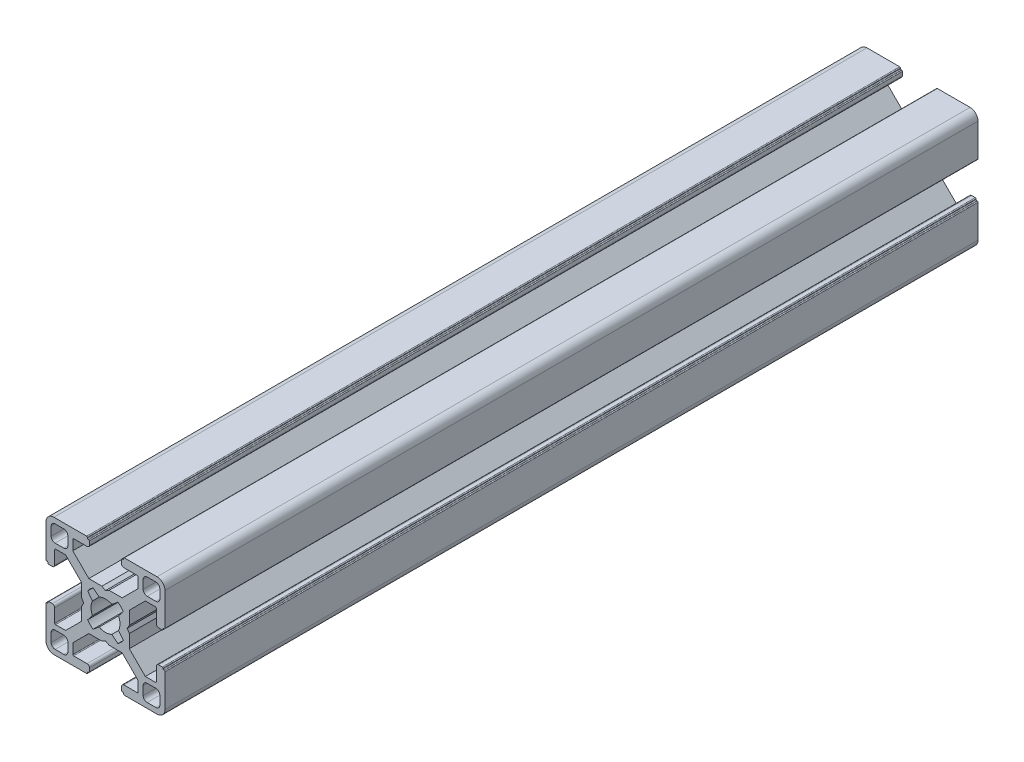
from build123d import *

# Parameters (mm, degrees)
BASE_EXTRUDE_DEPTH = 205


with BuildPart() as part:
    # Sketch1 → Base-Extrude (new body)
    with BuildSketch(Plane.XY):
        with BuildLine():
            Line((6.00446543, 0.899999619), (5.484852164, 0))
            Line((5.484852164, 0), (6.00446543, -0.899999619))
            Line((6.00446543, -0.899999619), (6.00446543, -4.204465866))
            Line((6.00446543, -4.204465866), (10.049999564, -8.25))
            Line((10.049999564, -8.25), (12.59999928, -8.25))
            ThreePointArc((12.59999928, -8.25), (12.741420837, -8.191421273), (12.799999564, -8.049999716))
            Line((12.799999564, -8.049999716), (12.799999564, -4.649999613))
            ThreePointArc((12.799999564, -4.649999613), (12.975735606, -4.225735278), (13.39999994, -4.049999237))
            Line((13.39999994, -4.049999237), (14.300000043, -4.049999237))
            ThreePointArc((14.300000043, -4.049999237), (14.4414216, -4.108577964), (14.500000327, -4.249999521))
            Line((14.500000327, -4.249999521), (14.500000327, -4.349998953))
            ThreePointArc((14.500000327, -4.349998953), (14.558579054, -4.49142051), (14.700000611, -4.549999237))
            Line((14.700000611, -4.549999237), (14.799999716, -4.549999237))
            ThreePointArc((14.799999716, -4.549999237), (14.941421273, -4.608577964), (15, -4.749999521))
            Line((15, -4.749999521), (15, -13.000000346))
            ThreePointArc((15, -13.000000346), (14.414213664, -14.414213664), (13.000000346, -15))
            Line((13.000000346, -15), (4.749999945, -15))
            ThreePointArc((4.749999945, -15), (4.60857832, -14.941421245), (4.549999564, -14.799999619))
            Line((4.549999564, -14.799999619), (4.549999564, -14.69999942))
            ThreePointArc((4.549999564, -14.69999942), (4.49142109, -14.558578474), (4.350000144, -14.5))
            Line((4.350000144, -14.5), (4.250000374, -14.5))
            ThreePointArc((4.250000374, -14.5), (4.108578753, -14.441421247), (4.05, -14.299999626))
            Line((4.05, -14.299999626), (4.05, -13.399999434))
            ThreePointArc((4.05, -13.399999434), (4.225735989, -12.975735226), (4.650000197, -12.799999237))
            Line((4.650000197, -12.799999237), (8.049999924, -12.799999237))
            ThreePointArc((8.049999924, -12.799999237), (8.191421565, -12.741420475), (8.250000327, -12.599998834))
            Line((8.250000327, -12.599998834), (8.250000327, -10.049999237))
            Line((8.250000327, -10.049999237), (4.204466193, -6))
            Line((4.204466193, -6), (0.899999946, -6))
            Line((0.899999946, -6), (0, -5.484851837))
            Line((0, -5.484851837), (-0.899999946, -6))
            Line((-0.899999946, -6), (-4.204466193, -6))
            Line((-4.204466193, -6), (-8.250000327, -10.049999237))
            Line((-8.250000327, -10.049999237), (-8.250000327, -12.599998834))
            ThreePointArc((-8.250000327, -12.599998834), (-8.191421565, -12.741420475), (-8.049999924, -12.799999237))
            Line((-8.049999924, -12.799999237), (-4.650000197, -12.799999237))
            ThreePointArc((-4.650000197, -12.799999237), (-4.225735989, -12.975735226), (-4.05, -13.399999434))
            Line((-4.05, -13.399999434), (-4.05, -14.299999626))
            ThreePointArc((-4.05, -14.299999626), (-4.108578753, -14.441421247), (-4.250000374, -14.5))
            Line((-4.250000374, -14.5), (-4.350000144, -14.5))
            ThreePointArc((-4.350000144, -14.5), (-4.49142109, -14.558578474), (-4.549999564, -14.69999942))
            Line((-4.549999564, -14.69999942), (-4.549999564, -14.799999619))
            ThreePointArc((-4.549999564, -14.799999619), (-4.60857832, -14.941421245), (-4.749999945, -15))
            Line((-4.749999945, -15), (-13.000000346, -15))
            ThreePointArc((-13.000000346, -15), (-14.414213664, -14.414213664), (-15, -13.000000346))
            Line((-15, -13.000000346), (-15, -4.749999521))
            ThreePointArc((-15, -4.749999521), (-14.941421273, -4.608577964), (-14.799999716, -4.549999237))
            Line((-14.799999716, -4.549999237), (-14.700000611, -4.549999237))
            ThreePointArc((-14.700000611, -4.549999237), (-14.558579054, -4.49142051), (-14.500000327, -4.349998953))
            Line((-14.500000327, -4.349998953), (-14.500000327, -4.249999521))
            ThreePointArc((-14.500000327, -4.249999521), (-14.4414216, -4.108577964), (-14.300000043, -4.049999237))
            Line((-14.300000043, -4.049999237), (-13.39999994, -4.049999237))
            ThreePointArc((-13.39999994, -4.049999237), (-12.975735606, -4.225735278), (-12.799999564, -4.649999613))
            Line((-12.799999564, -4.649999613), (-12.799999564, -8.049999716))
            ThreePointArc((-12.799999564, -8.049999716), (-12.741420837, -8.191421273), (-12.59999928, -8.25))
            Line((-12.59999928, -8.25), (-10.049999564, -8.25))
            Line((-10.049999564, -8.25), (-6.00446543, -4.204465866))
            Line((-6.00446543, -4.204465866), (-6.00446543, -0.899999619))
            Line((-6.00446543, -0.899999619), (-5.484852164, 0))
            Line((-5.484852164, 0), (-6.00446543, 0.899999619))
            Line((-6.00446543, 0.899999619), (-6.00446543, 4.204465866))
            Line((-6.00446543, 4.204465866), (-10.049999564, 8.25))
            Line((-10.049999564, 8.25), (-12.59999928, 8.25))
            ThreePointArc((-12.59999928, 8.25), (-12.741420837, 8.191421273), (-12.799999564, 8.049999716))
            Line((-12.799999564, 8.049999716), (-12.799999564, 4.649999613))
            ThreePointArc((-12.799999564, 4.649999613), (-12.975735606, 4.225735278), (-13.39999994, 4.049999237))
            Line((-13.39999994, 4.049999237), (-14.300000043, 4.049999237))
            ThreePointArc((-14.300000043, 4.049999237), (-14.4414216, 4.108577964), (-14.500000327, 4.249999521))
            Line((-14.500000327, 4.249999521), (-14.500000327, 4.349998953))
            ThreePointArc((-14.500000327, 4.349998953), (-14.558579054, 4.49142051), (-14.700000611, 4.549999237))
            Line((-14.700000611, 4.549999237), (-14.799999716, 4.549999237))
            ThreePointArc((-14.799999716, 4.549999237), (-14.941421273, 4.608577964), (-15, 4.749999521))
            Line((-15, 4.749999521), (-15, 13.000000346))
            ThreePointArc((-15, 13.000000346), (-14.414213664, 14.414213664), (-13.000000346, 15))
            Line((-13.000000346, 15), (-4.749999945, 15))
            ThreePointArc((-4.749999945, 15), (-4.60857832, 14.941421245), (-4.549999564, 14.799999619))
            Line((-4.549999564, 14.799999619), (-4.549999564, 14.69999942))
            ThreePointArc((-4.549999564, 14.69999942), (-4.49142109, 14.558578474), (-4.350000144, 14.5))
            Line((-4.350000144, 14.5), (-4.250000374, 14.5))
            ThreePointArc((-4.250000374, 14.5), (-4.108578753, 14.441421247), (-4.05, 14.299999626))
            Line((-4.05, 14.299999626), (-4.05, 13.399999434))
            ThreePointArc((-4.05, 13.399999434), (-4.225735989, 12.975735226), (-4.650000197, 12.799999237))
            Line((-4.650000197, 12.799999237), (-8.049999924, 12.799999237))
            ThreePointArc((-8.049999924, 12.799999237), (-8.191421565, 12.741420475), (-8.250000327, 12.599998834))
            Line((-8.250000327, 12.599998834), (-8.250000327, 10.049999237))
            Line((-8.250000327, 10.049999237), (-4.204466193, 6))
            Line((-4.204466193, 6), (-0.899999946, 6))
            Line((-0.899999946, 6), (0, 5.484851837))
            Line((0, 5.484851837), (0.899999946, 6))
            Line((0.899999946, 6), (4.204466193, 6))
            Line((4.204466193, 6), (8.250000327, 10.049999237))
            Line((8.250000327, 10.049999237), (8.250000327, 12.599998834))
            ThreePointArc((8.250000327, 12.599998834), (8.191421565, 12.741420475), (8.049999924, 12.799999237))
            Line((8.049999924, 12.799999237), (4.650000197, 12.799999237))
            ThreePointArc((4.650000197, 12.799999237), (4.225735989, 12.975735226), (4.05, 13.399999434))
            Line((4.05, 13.399999434), (4.05, 14.299999626))
            ThreePointArc((4.05, 14.299999626), (4.108578753, 14.441421247), (4.250000374, 14.5))
            Line((4.250000374, 14.5), (4.350000144, 14.5))
            ThreePointArc((4.350000144, 14.5), (4.49142109, 14.558578474), (4.549999564, 14.69999942))
            Line((4.549999564, 14.69999942), (4.549999564, 14.799999619))
            ThreePointArc((4.549999564, 14.799999619), (4.60857832, 14.941421245), (4.749999945, 15))
            Line((4.749999945, 15), (13.000000346, 15))
            ThreePointArc((13.000000346, 15), (14.414213664, 14.414213664), (15, 13.000000346))
            Line((15, 13.000000346), (15, 4.749999521))
            ThreePointArc((15, 4.749999521), (14.941421273, 4.608577964), (14.799999716, 4.549999237))
            Line((14.799999716, 4.549999237), (14.700000611, 4.549999237))
            ThreePointArc((14.700000611, 4.549999237), (14.558579054, 4.49142051), (14.500000327, 4.349998953))
            Line((14.500000327, 4.349998953), (14.500000327, 4.249999521))
            ThreePointArc((14.500000327, 4.249999521), (14.4414216, 4.108577964), (14.300000043, 4.049999237))
            Line((14.300000043, 4.049999237), (13.39999994, 4.049999237))
            ThreePointArc((13.39999994, 4.049999237), (12.975735606, 4.225735278), (12.799999564, 4.649999613))
            Line((12.799999564, 4.649999613), (12.799999564, 8.049999716))
            ThreePointArc((12.799999564, 8.049999716), (12.741420837, 8.191421273), (12.59999928, 8.25))
            Line((12.59999928, 8.25), (10.049999564, 8.25))
            Line((10.049999564, 8.25), (6.00446543, 4.204465866))
            Line((6.00446543, 4.204465866), (6.00446543, 0.899999619))
        make_face()
        with BuildLine():
            Line((13.70000109, 12.700000408), (13.70000109, 10.499999626))
            ThreePointArc((13.70000109, 10.499999626), (13.407107874, 9.792892851), (12.7000011, 9.499999635))
            Line((12.7000011, 9.499999635), (10.500000318, 9.499999635))
            ThreePointArc((10.500000318, 9.499999635), (9.792893543, 9.792892851), (9.500000327, 10.499999626))
            Line((9.500000327, 10.499999626), (9.500000327, 12.700000408))
            ThreePointArc((9.500000327, 12.700000408), (9.792893543, 13.407107182), (10.500000318, 13.700000398))
            Line((10.500000318, 13.700000398), (12.7000011, 13.700000398))
            ThreePointArc((12.7000011, 13.700000398), (13.407107874, 13.407107182), (13.70000109, 12.700000408))
        make_face(mode=Mode.SUBTRACT)
        with BuildLine():
            Line((3.135929412, 4.518400903), (1.600129524, 3.280561767))
            ThreePointArc((1.600129524, 3.280561767), (0, 3.65), (-1.600129524, 3.280561767))
            Line((-1.600129524, 3.280561767), (-3.135929412, 4.518400903))
            ThreePointArc((-3.135929412, 4.518400903), (-3.881002259, 3.897155561), (-4.505336892, 3.154669473))
            Line((-4.505336892, 3.154669473), (-3.280561732, 1.600129597))
            ThreePointArc((-3.280561732, 1.600129597), (-3.65, 0), (-3.280561732, -1.600129597))
            Line((-3.280561732, -1.600129597), (-4.505336892, -3.154669473))
            ThreePointArc((-4.505336892, -3.154669473), (-3.881002259, -3.897155561), (-3.135929412, -4.518400903))
            Line((-3.135929412, -4.518400903), (-1.600129524, -3.280561767))
            ThreePointArc((-1.600129524, -3.280561767), (0, -3.65), (1.600129524, -3.280561767))
            Line((1.600129524, -3.280561767), (3.135929412, -4.518400903))
            ThreePointArc((3.135929412, -4.518400903), (3.881002259, -3.897155561), (4.505336892, -3.154669473))
            Line((4.505336892, -3.154669473), (3.280561732, -1.600129597))
            ThreePointArc((3.280561732, -1.600129597), (3.65, 0), (3.280561732, 1.600129597))
            Line((3.280561732, 1.600129597), (4.505336892, 3.154669473))
            ThreePointArc((4.505336892, 3.154669473), (3.881002259, 3.897155561), (3.135929412, 4.518400903))
        make_face(mode=Mode.SUBTRACT)
        with BuildLine():
            Line((-13.70000109, -12.700000408), (-13.70000109, -10.499999626))
            ThreePointArc((-13.70000109, -10.499999626), (-13.407107874, -9.792892851), (-12.7000011, -9.499999635))
            Line((-12.7000011, -9.499999635), (-10.500000318, -9.499999635))
            ThreePointArc((-10.500000318, -9.499999635), (-9.792893543, -9.792892851), (-9.500000327, -10.499999626))
            Line((-9.500000327, -10.499999626), (-9.500000327, -12.700000408))
            ThreePointArc((-9.500000327, -12.700000408), (-9.792893543, -13.407107182), (-10.500000318, -13.700000398))
            Line((-10.500000318, -13.700000398), (-12.7000011, -13.700000398))
            ThreePointArc((-12.7000011, -13.700000398), (-13.407107874, -13.407107182), (-13.70000109, -12.700000408))
        make_face(mode=Mode.SUBTRACT)
        with BuildLine():
            Line((10.500000318, -13.700000398), (12.7000011, -13.700000398))
            ThreePointArc((12.7000011, -13.700000398), (13.407107874, -13.407107182), (13.70000109, -12.700000408))
            Line((13.70000109, -12.700000408), (13.70000109, -10.499999626))
            ThreePointArc((13.70000109, -10.499999626), (13.407107874, -9.792892851), (12.7000011, -9.499999635))
            Line((12.7000011, -9.499999635), (10.500000318, -9.499999635))
            ThreePointArc((10.500000318, -9.499999635), (9.792893543, -9.792892851), (9.500000327, -10.499999626))
            Line((9.500000327, -10.499999626), (9.500000327, -12.700000408))
            ThreePointArc((9.500000327, -12.700000408), (9.792893543, -13.407107182), (10.500000318, -13.700000398))
        make_face(mode=Mode.SUBTRACT)
        with BuildLine():
            Line((-10.500000318, 13.700000398), (-12.7000011, 13.700000398))
            ThreePointArc((-12.7000011, 13.700000398), (-13.407107874, 13.407107182), (-13.70000109, 12.700000408))
            Line((-13.70000109, 12.700000408), (-13.70000109, 10.499999626))
            ThreePointArc((-13.70000109, 10.499999626), (-13.407107874, 9.792892851), (-12.7000011, 9.499999635))
            Line((-12.7000011, 9.499999635), (-10.500000318, 9.499999635))
            ThreePointArc((-10.500000318, 9.499999635), (-9.792893543, 9.792892851), (-9.500000327, 10.499999626))
            Line((-9.500000327, 10.499999626), (-9.500000327, 12.700000408))
            ThreePointArc((-9.500000327, 12.700000408), (-9.792893543, 13.407107182), (-10.500000318, 13.700000398))
        make_face(mode=Mode.SUBTRACT)
    extrude(amount=-BASE_EXTRUDE_DEPTH)


solid = part.part
